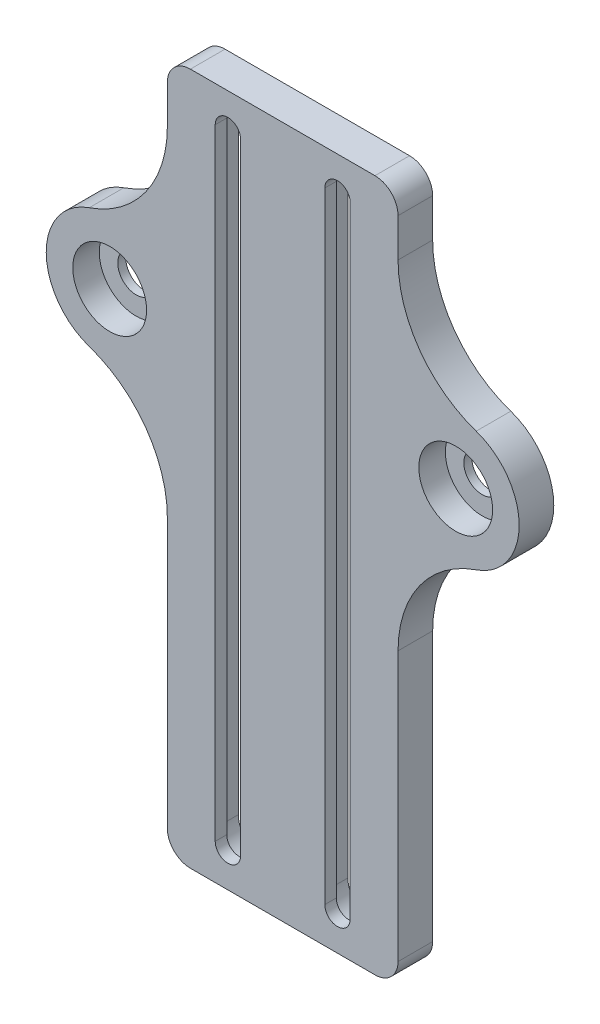
from build123d import *

# Parameters (mm, degrees)
BOSS_EXTRUDE1_DEPTH = 3
SKETCH2_R           = 1.6
CUT_EXTRUDE1_DEPTH  = 37.458880948
SKETCH3_R           = 3.2
CUT_EXTRUDE2_DEPTH  = 2.3
CUT_EXTRUDE3_DEPTH  = 2
FILLET1_R           = 2


with BuildPart() as part:
    # Sketch1 → Boss-Extrude1 (new body)
    with BuildSketch(Plane.XY):
        with BuildLine():
            Line((-10, -30), (10, -30))
            Line((10, -30), (10, -4.671400751))
            ThreePointArc((10, -4.671400751), (11.868024086, 1.148476201), (16.774193548, 4.794019088))
            ThreePointArc((16.774193548, 4.794019088), (20.5, 10), (16.774193548, 15.205980912))
            ThreePointArc((16.774193548, 15.205980912), (11.868024086, 18.851523799), (10, 24.671400751))
            Line((10, 24.671400751), (10, 30))
            Line((10, 30), (-10, 30))
            Line((-10, 30), (-10, 24.671400751))
            ThreePointArc((-10, 24.671400751), (-11.868024086, 18.851523799), (-16.774193548, 15.205980912))
            ThreePointArc((-16.774193548, 15.205980912), (-20.5, 10), (-16.774193548, 4.794019088))
            ThreePointArc((-16.774193548, 4.794019088), (-11.868024086, 1.148476201), (-10, -4.671400751))
            Line((-10, -4.671400751), (-10, -30))
        make_face()
    extrude(amount=BOSS_EXTRUDE1_DEPTH)

    # Sketch2 → Cut-Extrude1 (cut, through all)
    with BuildSketch(Plane.XY.offset(3)):
        with Locations((-15, 10)):
            Circle(SKETCH2_R)
        with Locations((15, 10)):
            Circle(SKETCH2_R)
        with BuildLine():
            Line((-3.65, 26.9), (-3.65, -26.9))
            ThreePointArc((-3.65, -26.9), (-4.75, -28), (-5.85, -26.9))
            Line((-5.85, -26.9), (-5.85, 26.9))
            ThreePointArc((-5.85, 26.9), (-4.75, 28), (-3.65, 26.9))
        make_face()
        with BuildLine():
            Line((5.85, 26.9), (5.85, -26.9))
            ThreePointArc((5.85, -26.9), (4.75, -28), (3.65, -26.9))
            Line((3.65, -26.9), (3.65, 26.9))
            ThreePointArc((3.65, 26.9), (4.75, 28), (5.85, 26.9))
        make_face()
    extrude(amount=-CUT_EXTRUDE1_DEPTH, mode=Mode.SUBTRACT)

    # Sketch3 → Cut-Extrude2 (cut)
    with BuildSketch(Plane.XY.offset(3)):
        with Locations((-15, 10)):
            Circle(SKETCH3_R)
        with Locations((15, 10)):
            Circle(SKETCH3_R)
    extrude(amount=-CUT_EXTRUDE2_DEPTH, mode=Mode.SUBTRACT)

    # Sketch4 → Cut-Extrude3 (cut)
    with BuildSketch(Plane(origin=(0, 0, 0), x_dir=(-1, 0, 0), z_dir=(0, 0, -1))):
        with BuildLine():
            Line((-2.65, 26.9), (-2.65, -26.9))
            ThreePointArc((-2.65, -26.9), (-4.75, -29), (-6.85, -26.9))
            Line((-6.85, -26.9), (-6.85, 26.9))
            ThreePointArc((-6.85, 26.9), (-4.75, 29), (-2.65, 26.9))
        make_face()
        with BuildLine():
            Line((2.65, -26.9), (2.65, 26.9))
            ThreePointArc((2.65, 26.9), (4.75, 29), (6.85, 26.9))
            Line((6.85, 26.9), (6.85, -26.9))
            ThreePointArc((6.85, -26.9), (4.75, -29), (2.65, -26.9))
        make_face()
    extrude(amount=-CUT_EXTRUDE3_DEPTH, mode=Mode.SUBTRACT)

    # Fillet1
    fillet1_edges = [part.edges().sort_by_distance(p)[0] for p in [
        (10, -30, 1.5),
        (-10, -30, 1.5),
        (-10, 30, 1.5),
        (10, 30, 1.5),
    ]]
    fillet(fillet1_edges, radius=FILLET1_R)


solid = part.part
